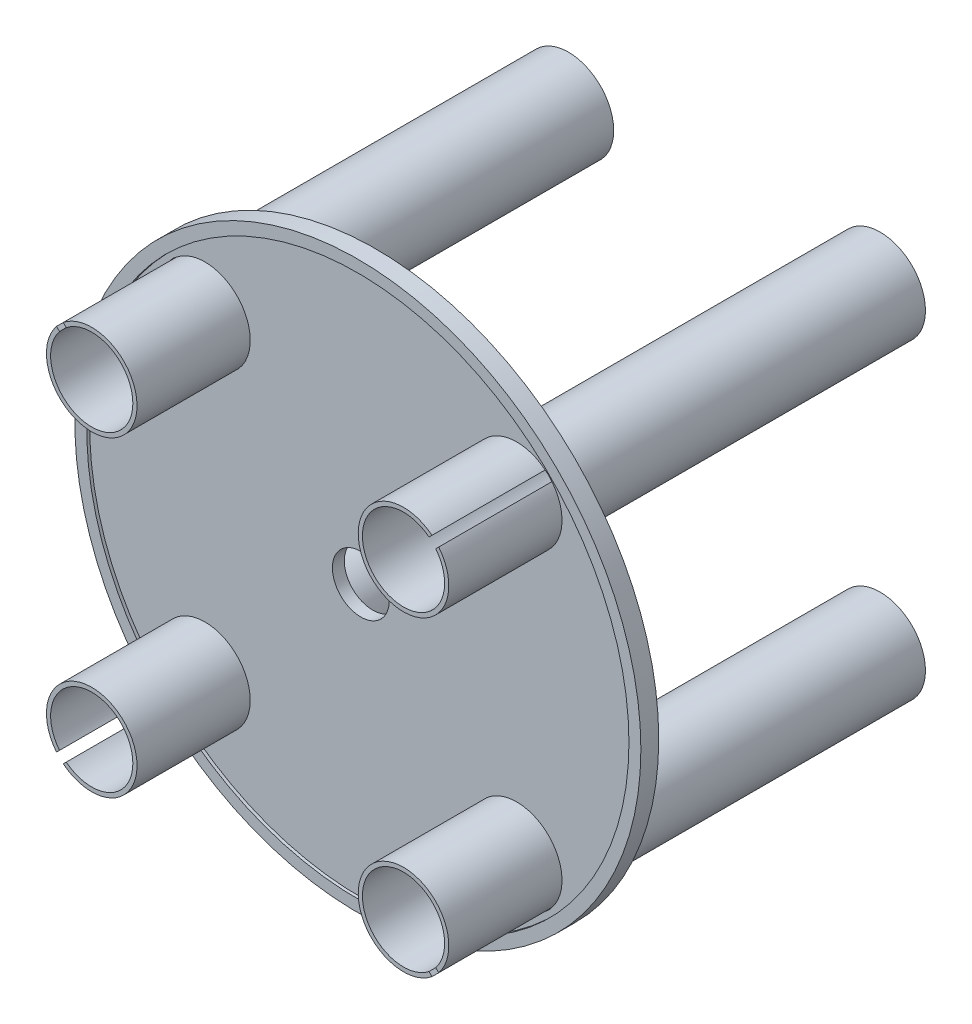
from build123d import *

# Parameters (mm, degrees)
BOSS_EXTRUDE1_DEPTH      = 1
BOSS_EXTRUDE1_DEPTH_BACK = 1
SKETCH1_R                = 45.5
SKETCH1_R_2              = 7.6
SKETCH1_R_3              = 4.774915174
BOSS_EXTRUDE2_DEPTH      = 1.5
BOSS_EXTRUDE2_DEPTH_BACK = 1.5
SKETCH1_3_R              = 47.5
SKETCH1_3_R_2            = 45.5
BOSS_EXTRUDE6_DEPTH      = 20
BOSS_EXTRUDE6_DEPTH_BACK = 60
SKETCH1_6_R              = 7.6
SKETCH1_6_R_2            = 6.9
CUT_EXTRUDE1_DEPTH       = 20


with BuildPart() as part:
    # Sketch1 → Boss-Extrude1 (new, two sides: drawn at the far end of the back side and taken through both)
    with BuildSketch(Plane.XY.offset(-BOSS_EXTRUDE1_DEPTH_BACK)):
        Circle(SKETCH1_R)
        with Locations((-26.162950904, -26.162950904)):
            Circle(SKETCH1_R_2, mode=Mode.SUBTRACT)
        with Locations((26.162950904, -26.162950904)):
            Circle(SKETCH1_R_2, mode=Mode.SUBTRACT)
        with BuildLine():
            ThreePointArc((-29.897696331, 32.781989852), (-22.330462499, 32.725879566), (-18.562950904, 26.162950904))
            ThreePointArc((-18.562950904, 26.162950904), (-18.81283434, 24.230132624), (-19.546052615, 22.424414153))
            ThreePointArc((-19.546052615, 22.424414153), (-20.782603043, 20.795283171), (-22.408811817, 19.554892209))
            ThreePointArc((-22.408811817, 19.554892209), (-31.538501561, 20.790478928), (-32.768857831, 29.920875021))
            ThreePointArc((-32.768857831, 29.920875021), (-31.527535445, 31.546372929), (-29.897696331, 32.781989852))
        make_face(mode=Mode.SUBTRACT)
        Circle(SKETCH1_R_3, mode=Mode.SUBTRACT)
        with Locations((26.162950904, 26.162950904)):
            Circle(SKETCH1_R_2, mode=Mode.SUBTRACT)
    extrude(amount=BOSS_EXTRUDE1_DEPTH + BOSS_EXTRUDE1_DEPTH_BACK)

    # Sketch1<3> → Boss-Extrude2 (add, two sides: drawn at the far end of the back side and taken through both)
    with BuildSketch(Plane.XY.offset(-BOSS_EXTRUDE2_DEPTH_BACK)):
        Circle(SKETCH1_3_R)
        Circle(SKETCH1_3_R_2, mode=Mode.SUBTRACT)
    extrude(amount=BOSS_EXTRUDE2_DEPTH + BOSS_EXTRUDE2_DEPTH_BACK)

    # Sketch1<6> → Boss-Extrude6 (add, two sides: drawn at the far end of the back side and taken through both)
    # profile 1 of 4: a face of its own
    with BuildSketch(Plane.XY.offset(-BOSS_EXTRUDE6_DEPTH_BACK)):
        with Locations((-26.162950904, 26.162950904)):
            Circle(SKETCH1_6_R)
        with Locations((-26.162950904, 26.162950904)):
            Circle(SKETCH1_6_R_2, mode=Mode.SUBTRACT)
    # profile 2 of 4: a face of its own
    with BuildSketch(Plane.XY.offset(-BOSS_EXTRUDE6_DEPTH_BACK)):
        with Locations((26.162950904, 26.162950904)):
            Circle(SKETCH1_6_R)
        with Locations((26.162950904, 26.162950904)):
            Circle(SKETCH1_6_R_2, mode=Mode.SUBTRACT)
    # profile 3 of 4: a face of its own
    with BuildSketch(Plane.XY.offset(-BOSS_EXTRUDE6_DEPTH_BACK)):
        with Locations((26.162950904, -26.162950904)):
            Circle(SKETCH1_6_R)
        with Locations((26.162950904, -26.162950904)):
            Circle(SKETCH1_6_R_2, mode=Mode.SUBTRACT)
    # profile 4 of 4: a face of its own
    with BuildSketch(Plane.XY.offset(-BOSS_EXTRUDE6_DEPTH_BACK)):
        with Locations((-26.162950904, -26.162950904)):
            Circle(SKETCH1_6_R)
        with Locations((-26.162950904, -26.162950904)):
            Circle(SKETCH1_6_R_2, mode=Mode.SUBTRACT)
    extrude(amount=BOSS_EXTRUDE6_DEPTH + BOSS_EXTRUDE6_DEPTH_BACK)

    # Sketch2 → Cut-Extrude1 (cut)
    with BuildSketch(Plane.XY.offset(20)):
        Polygon((-31.533797235, 30.40024079), (-30.40024079, 31.533797235), (-30.940212581, 32.073769026), (-31.567102172, 31.567102172), (-32.073769026, 30.940212581), align=None)
        Polygon((31.533797235, 30.40024079), (32.073769026, 30.940212581), (31.567102172, 31.567102172), (30.940212581, 32.073769026), (30.40024079, 31.533797235), align=None)
        Polygon((30.40024079, -31.533797235), (30.940212581, -32.073769026), (31.567102172, -31.567102172), (32.073769026, -30.940212581), (31.533797235, -30.40024079), align=None)
        Polygon((-31.533797235, -30.40024079), (-32.073769026, -30.940212581), (-31.567102172, -31.567102172), (-30.940212581, -32.073769026), (-30.40024079, -31.533797235), align=None)
    extrude(amount=-CUT_EXTRUDE1_DEPTH, mode=Mode.SUBTRACT)


solid = part.part
